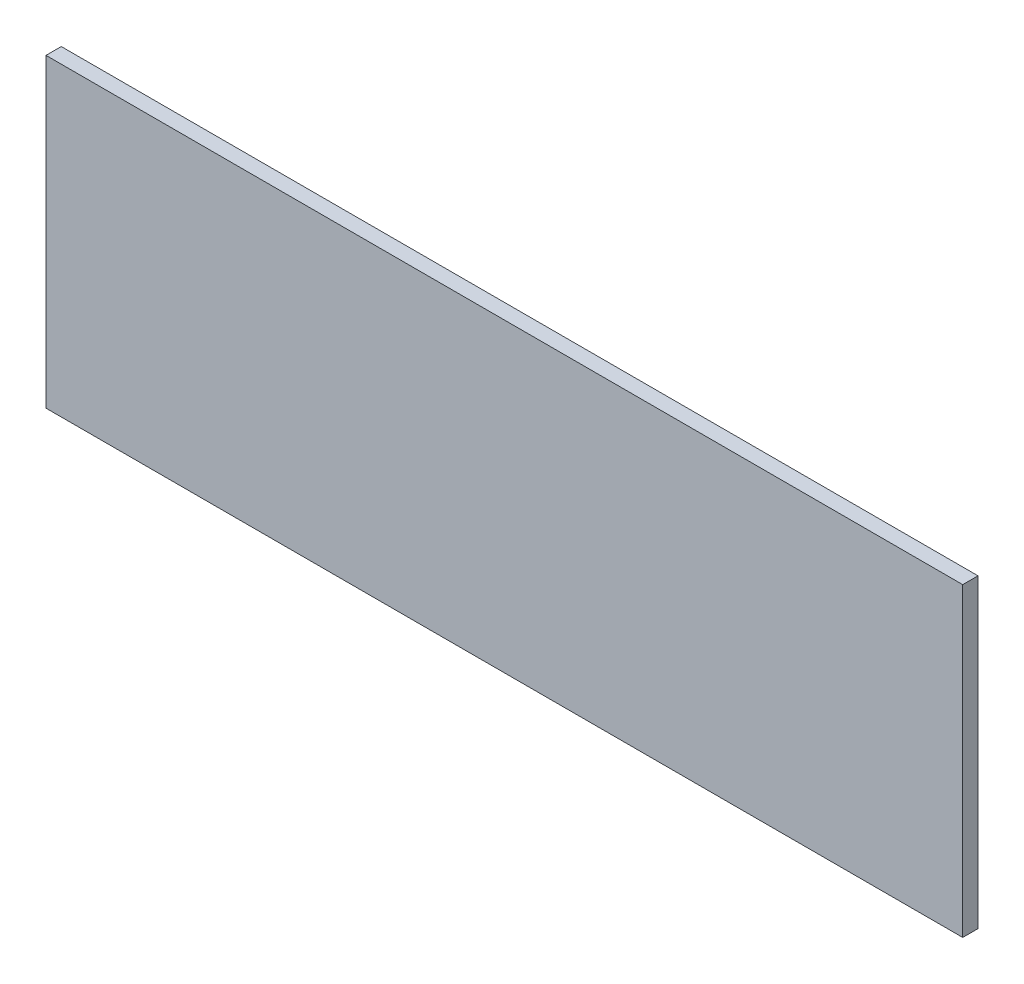
from build123d import *

# Parameters (mm, degrees)
SKETCH_1_W      = 12000
SKETCH_1_H      = 4000
EXTRUDE_1_DEPTH = 200


with BuildPart() as part:
    # 草图1 → 凸台-拉伸1 (new body)
    with BuildSketch(Plane.XY):
        Rectangle(SKETCH_1_W, SKETCH_1_H)
    extrude(amount=EXTRUDE_1_DEPTH)


solid = part.part
